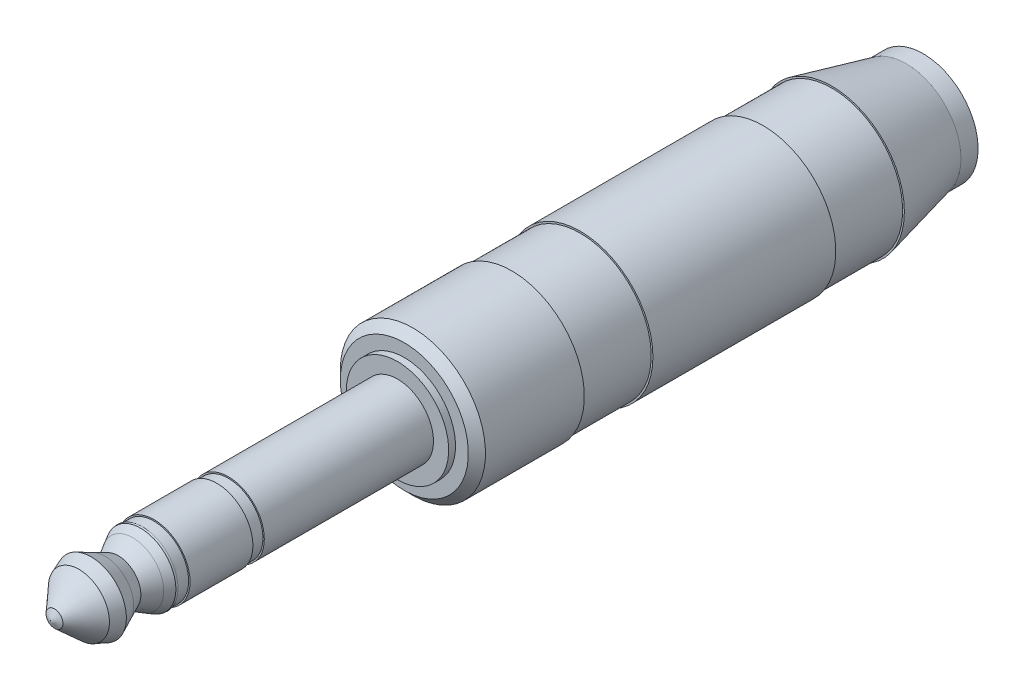
from build123d import *

# Parameters (mm, degrees)
SKETCH2_W = 0.37
SKETCH2_H = 1
SKETCH3_W = 0.4
SKETCH3_H = 6
SKETCH4_W = 3.1
SKETCH4_H = 4.5


with BuildPart() as part:
    # Sketch1 → Body (revolve)
    with BuildSketch(Plane(origin=(0, 0, 0), x_dir=(-1, 0, 0), z_dir=(0, 1, 0)), mode=Mode.PRIVATE) as body_sk:
        Polygon((0, 30.34), (-0.74, 30.01), (-2.67, 27.87), (-3.08, 26.8), (-2.51, 25.58), (-1.98, 24.43), (-2.7, 23.15), (-3.08, 22.47), (-3.15, 21.84), (-3.15, 0), (-4.48, 0), (-4.48, -0.6), (-5.6, -0.6), (-6.35, -1.35), (-6.35, -38), (-4.8, -44.5), (-4.8, -46), (0, -46), align=None)
    revolve(body_sk.sketch.rotate(Axis((0, 0, -200), (0, 0, 1)), 180), axis=Axis((0, 0, -200), (0, 0, 1)))

    # Sketch2 → Insulators (revolve, cut)
    with BuildSketch(Plane(origin=(0, 0, 0), x_dir=(-1, 0, 0), z_dir=(0, 1, 0)), mode=Mode.PRIVATE) as insulators_sk:
        with Locations((-3.215, 21.8)):
            Rectangle(SKETCH2_W, SKETCH2_H)
        with Locations((-3.215, 15.3)):
            Rectangle(SKETCH2_W, SKETCH2_H)
    revolve(insulators_sk.sketch.rotate(Axis((0, 0, -200), (0, 0, 1)), 180), axis=Axis((0, 0, -200), (0, 0, 1)), mode=Mode.SUBTRACT)

    # Sketch3 → Grip (revolve, cut)
    with BuildSketch(Plane(origin=(0, 0, 0), x_dir=(-1, 0, 0), z_dir=(0, 1, 0)), mode=Mode.PRIVATE) as grip_sk:
        with Locations((-6.4, -13)):
            Rectangle(SKETCH3_W, SKETCH3_H)
        with Locations((-6.4, -35)):
            Rectangle(SKETCH3_W, SKETCH3_H)
    revolve(grip_sk.sketch.rotate(Axis((0, 0, -200), (0, 0, 1)), 180), axis=Axis((0, 0, -200), (0, 0, 1)), mode=Mode.SUBTRACT)

    # Sketch4 → CableBore (revolve, cut)
    with BuildSketch(Plane(origin=(0, 0, 0), x_dir=(-1, 0, 0), z_dir=(0, 1, 0))):
        with Locations((-1.55, -44.25)):
            Rectangle(SKETCH4_W, SKETCH4_H)
    revolve(axis=Axis((0, 0, -200), (0, 0, 1)), mode=Mode.SUBTRACT)


solid = part.part
